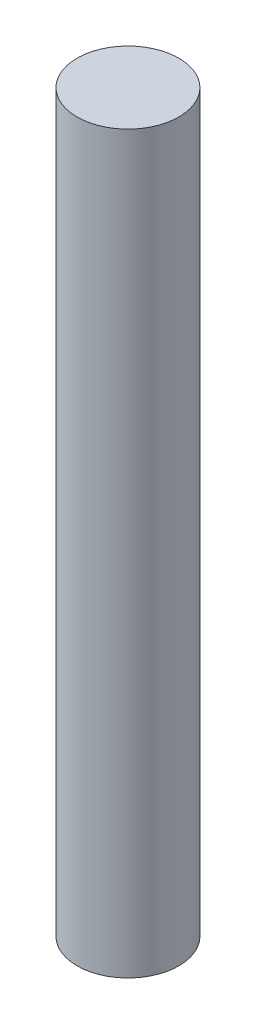
from build123d import *

# Parameters (mm, degrees)
SKETCH1_R           = 49.149
BOSS_EXTRUDE1_DEPTH = 709.676


with BuildPart() as part:
    # Sketch1 → Boss-Extrude1 (new body)
    with BuildSketch(Plane(origin=(0, 0, 0), x_dir=(1, 0, 0), z_dir=(0, 1, 0))):
        with Locations(Location((0, 0, 0), (0, 0, 270))):
            Circle(SKETCH1_R)
    extrude(amount=BOSS_EXTRUDE1_DEPTH)


solid = part.part
